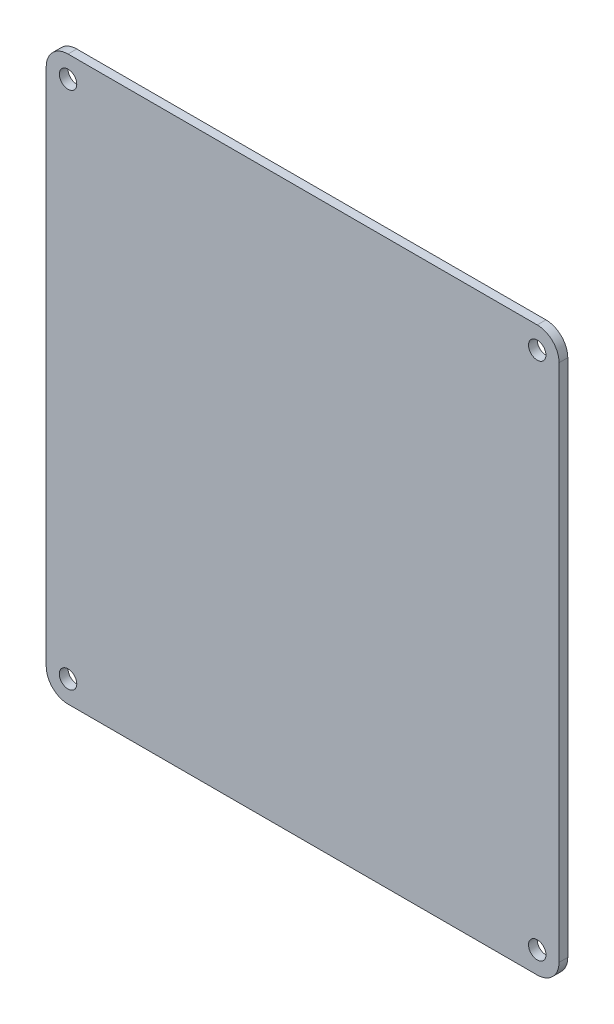
from build123d import *

# Parameters (mm, degrees)
SKETCH1_R           = 2
BOSS_EXTRUDE1_DEPTH = 2


with BuildPart() as part:
    # Sketch1 → Boss-Extrude1 (new body)
    with BuildSketch(Plane.XY):
        with BuildLine():
            Line((69, -42.5), (176.5, -42.5))
            ThreePointArc((176.5, -42.5), (180.035533906, -43.964466094), (181.5, -47.5))
            Line((181.5, -47.5), (181.5, -166.5))
            ThreePointArc((181.5, -166.5), (180.035533906, -170.035533906), (176.5, -171.5))
            Line((176.5, -171.5), (69, -171.5))
            ThreePointArc((69, -171.5), (65.464466094, -170.035533906), (64, -166.5))
            Line((64, -166.5), (64, -47.5))
            ThreePointArc((64, -47.5), (65.464466094, -43.964466094), (69, -42.5))
        make_face()
        with Locations((69, -47.5)):
            Circle(SKETCH1_R, mode=Mode.SUBTRACT)
        with Locations((176.5, -47.5)):
            Circle(SKETCH1_R, mode=Mode.SUBTRACT)
        with Locations((69, -166.5)):
            Circle(SKETCH1_R, mode=Mode.SUBTRACT)
        with Locations((176.5, -166.5)):
            Circle(SKETCH1_R, mode=Mode.SUBTRACT)
    extrude(amount=BOSS_EXTRUDE1_DEPTH)


solid = part.part
